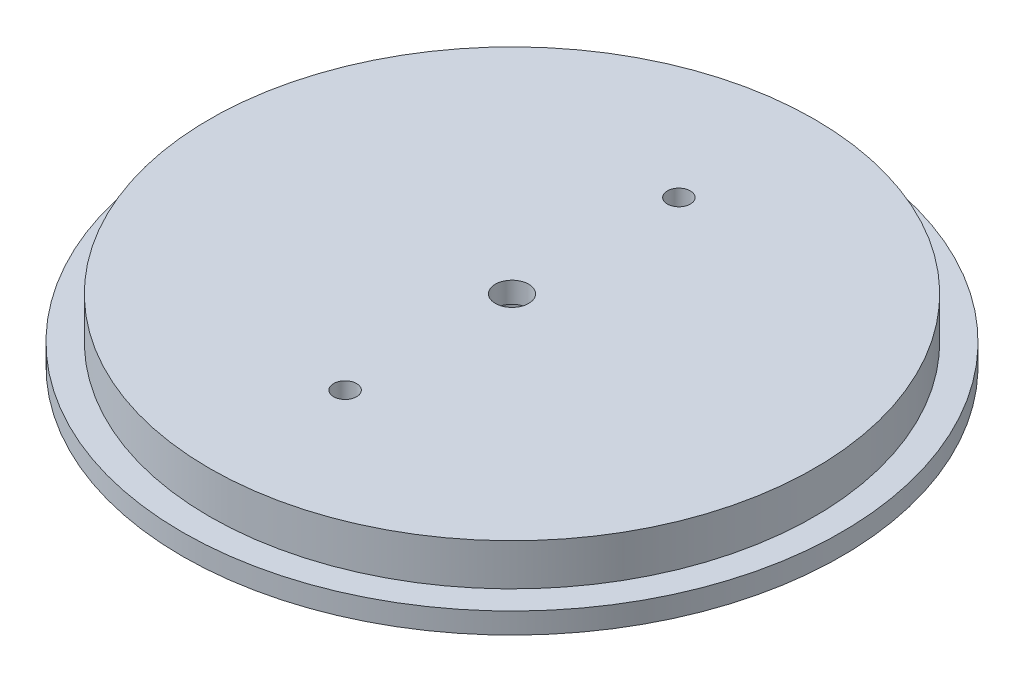
from build123d import *

# Parameters (mm, degrees)
SKETCH1_R           = 79
BOSS_EXTRUDE1_DEPTH = 5
SKETCH2_R           = 72.5
BOSS_EXTRUDE2_DEPTH = 10
SKETCH3_R           = 2.75
CUT_EXTRUDE1_DEPTH  = 113.725329895
SKETCH4_R           = 4
CUT_EXTRUDE2_DEPTH  = 5
SKETCH5_R           = 6
CUT_EXTRUDE3_DEPTH  = 10


with BuildPart() as part:
    # Sketch1 → Boss-Extrude1 (new body)
    with BuildSketch(Plane(origin=(0, 0, 0), x_dir=(1, 0, 0), z_dir=(0, 1, 0))):
        with Locations(Location((0, 0, 0), (0, 0, 270))):
            Circle(SKETCH1_R)
    extrude(amount=BOSS_EXTRUDE1_DEPTH)

    # Sketch2 → Boss-Extrude2 (add)
    with BuildSketch(Plane(origin=(0, 5, 0), x_dir=(1, 0, 0), z_dir=(0, 1, 0))):
        with Locations(Location((0, 0, 0), (0, 0, 270))):
            Circle(SKETCH2_R)
    extrude(amount=BOSS_EXTRUDE2_DEPTH)

    # Sketch3 → Cut-Extrude1 (cut, through all)
    with BuildSketch(Plane(origin=(0, 15, 0), x_dir=(1, 0, 0), z_dir=(0, 1, 0))):
        with Locations(Location((0, 40, 0), (0, 0, 270))):
            Circle(SKETCH3_R)
        with Locations(Location((0, -40, 0), (0, 0, 270))):
            Circle(SKETCH3_R)
    extrude(amount=-CUT_EXTRUDE1_DEPTH, mode=Mode.SUBTRACT)

    # Sketch4 → Cut-Extrude2 (cut)
    with BuildSketch(Plane(origin=(0, 15, 0), x_dir=(1, 0, 0), z_dir=(0, 1, 0))):
        with Locations(Location((0, 0, 0), (0, 0, 270))):
            Circle(SKETCH4_R)
    extrude(amount=-CUT_EXTRUDE2_DEPTH, mode=Mode.SUBTRACT)

    # Sketch5 → Cut-Extrude3 (cut)
    with BuildSketch(Plane.XZ):
        with Locations(Location((0, 0, 0), (0, 0, 270))):
            Circle(SKETCH5_R)
    extrude(amount=-CUT_EXTRUDE3_DEPTH, mode=Mode.SUBTRACT)


solid = part.part
